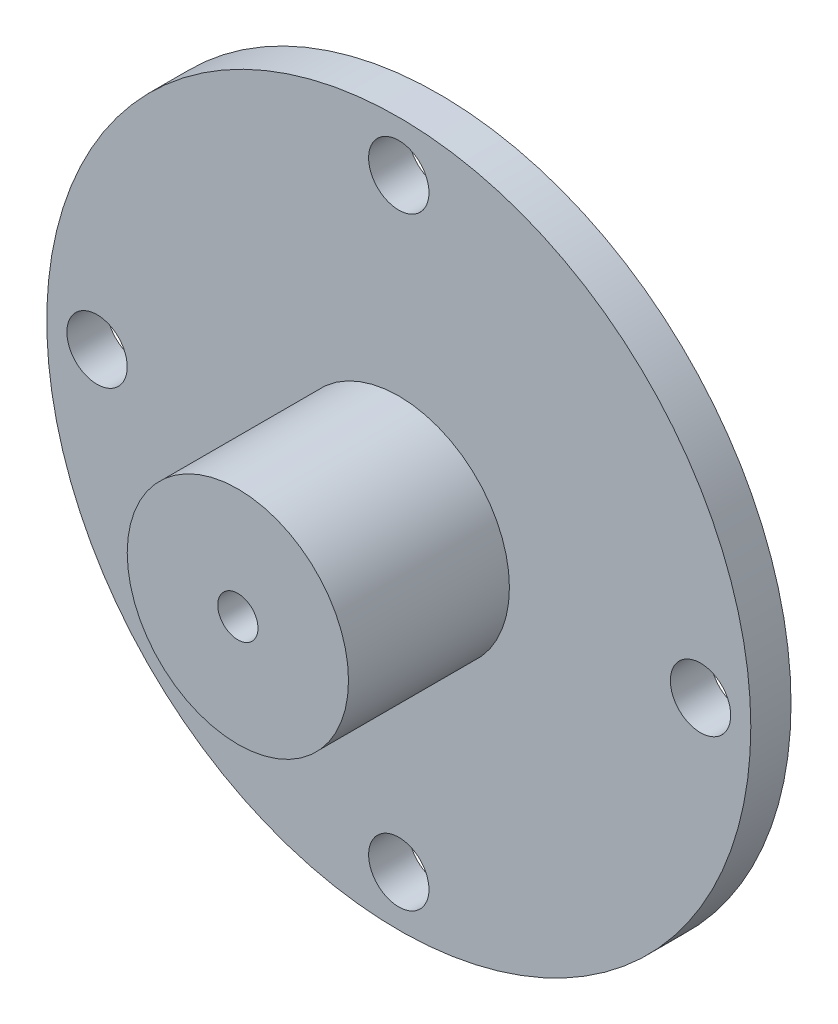
from build123d import *

# Parameters (mm, degrees)
SKETCH1_R                       = 17.5
SKETCH1_R_2                     = 1.5
SKETCH1_R_3                     = 5.5
BOSS_EXTRUDE1_DEPTH             = 2
SKETCH1_8_R                     = 5.5
BOSS_EXTRUDE3_DEPTH             = 10
TAP_DRILL_FOR_M2X0_4_TAP1_D     = 2
TAP_DRILL_FOR_M2X0_4_TAP1_DEPTH = 3
TAP_DRILL_FOR_M2X0_4_TAP1_TIP   = 0.600860619


with BuildPart() as part:
    # Sketch1 → Boss-Extrude1 (new body)
    with BuildSketch(Plane.XY):
        Circle(SKETCH1_R)
        with Locations((0, -15)):
            Circle(SKETCH1_R_2, mode=Mode.SUBTRACT)
        with Locations((-15, 0)):
            Circle(SKETCH1_R_2, mode=Mode.SUBTRACT)
        Circle(SKETCH1_R_3, mode=Mode.SUBTRACT)
        with Locations((15, 0)):
            Circle(SKETCH1_R_2, mode=Mode.SUBTRACT)
        with Locations((0, 15)):
            Circle(SKETCH1_R_2, mode=Mode.SUBTRACT)
    extrude(amount=BOSS_EXTRUDE1_DEPTH)

    # Sketch1<8> → Boss-Extrude3 (add)
    with BuildSketch(Plane.XY):
        Circle(SKETCH1_8_R)
    extrude(amount=BOSS_EXTRUDE3_DEPTH)

    # Tap Drill for M2x0.4 Tap1
    with Locations(Plane.XY.offset(10)):
        with Locations((0, 0)):
            Hole(TAP_DRILL_FOR_M2X0_4_TAP1_D / 2, depth=TAP_DRILL_FOR_M2X0_4_TAP1_DEPTH)
            with Locations((0, 0, -(TAP_DRILL_FOR_M2X0_4_TAP1_DEPTH + TAP_DRILL_FOR_M2X0_4_TAP1_TIP / 2))):  # 118° drill point
                Cone(0, TAP_DRILL_FOR_M2X0_4_TAP1_D / 2, TAP_DRILL_FOR_M2X0_4_TAP1_TIP, mode=Mode.SUBTRACT)


solid = part.part
